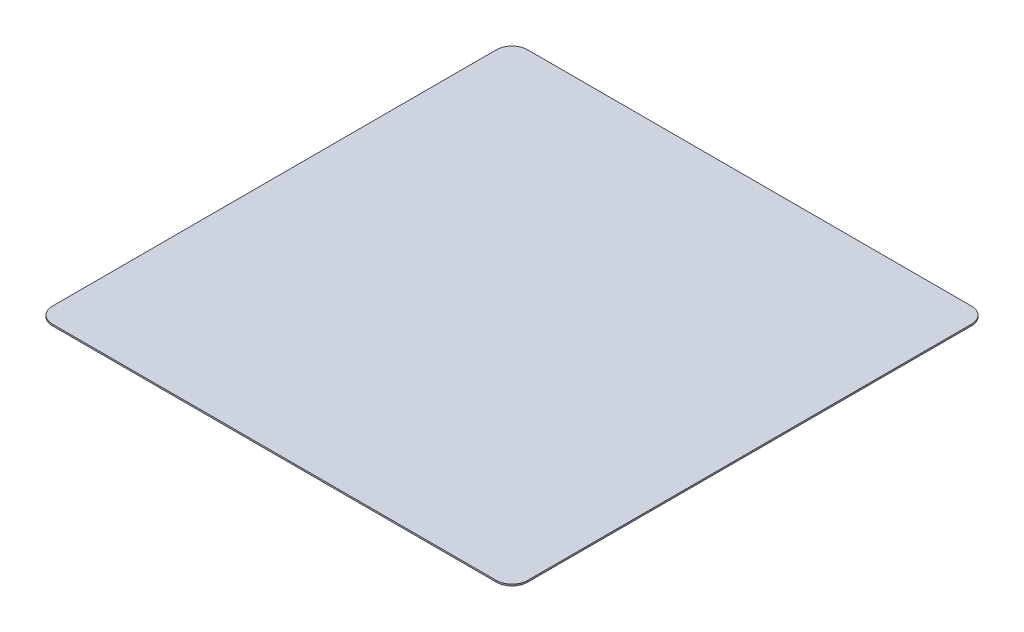
from build123d import *

# Parameters (mm, degrees)
SKETCH1_W           = 305
SKETCH1_H           = 305
BOSS_EXTRUDE1_DEPTH = 1
FILLET1_R           = 10


with BuildPart() as part:
    # Sketch1 → Boss-Extrude1 (new body)
    with BuildSketch(Plane(origin=(0, 0, 0), x_dir=(1, 0, 0), z_dir=(0, 1, 0))):
        with Locations((152.5, 152.5)):
            Rectangle(SKETCH1_W, SKETCH1_H)
    extrude(amount=BOSS_EXTRUDE1_DEPTH)

    # Fillet1
    fillet1_edges = [part.edges().sort_by_distance(p)[0] for p in [
        (0, 0.5, -305),
        (305, 0.5, -305),
        (305, 0.5, 0),
        (0, 0.5, 0),
    ]]
    fillet(fillet1_edges, radius=FILLET1_R)


solid = part.part
